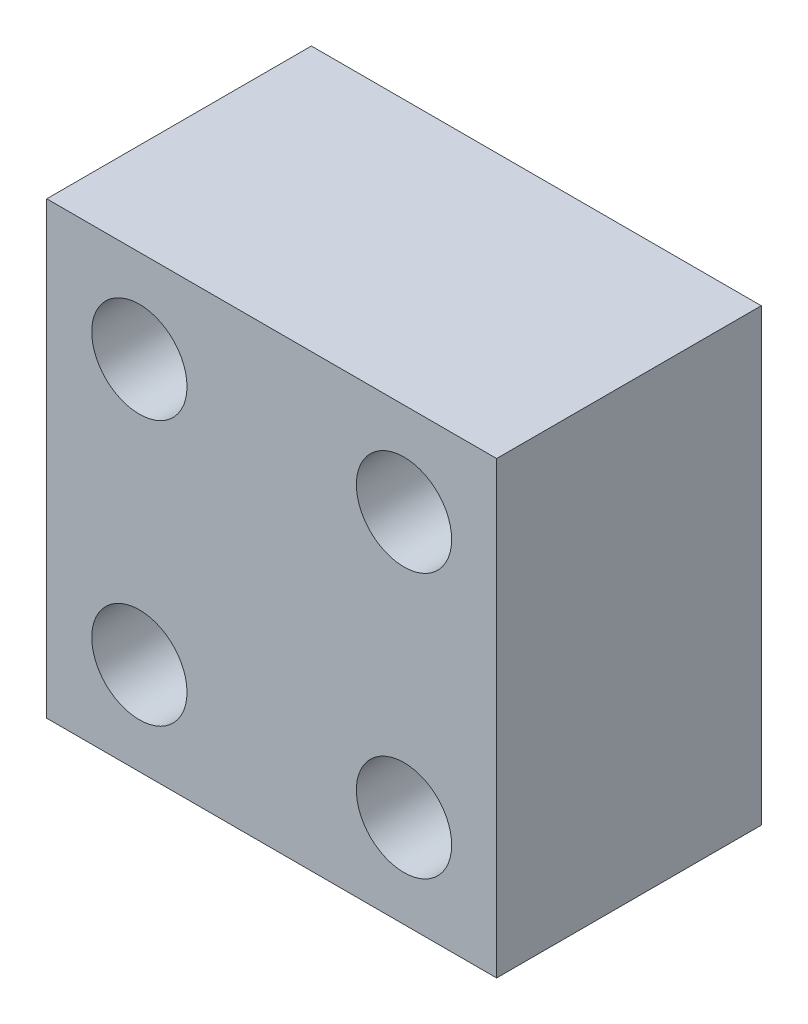
from build123d import *

# Parameters (mm, degrees)
SKETCH1_W            = 17
SKETCH1_H            = 17
BOSS_EXTRUDE1_DEPTH  = 10
M3_CLEARANCE_HOLE1_D = 3.6


with BuildPart() as part:
    # Sketch1 → Boss-Extrude1 (new body)
    with BuildSketch(Plane.XY):
        with Locations((160.500000073, 95.498999469)):
            Rectangle(SKETCH1_W, SKETCH1_H)
    extrude(amount=BOSS_EXTRUDE1_DEPTH)

    # M3 Clearance Hole1 (through all)
    with Locations(Plane.XY.offset(10)):
        with Locations((155.500000073, 100.498999469), (155.500000073, 90.498999469), (165.500000073, 90.498999469), (165.500000073, 100.498999469)):
            Hole(M3_CLEARANCE_HOLE1_D / 2)


solid = part.part
